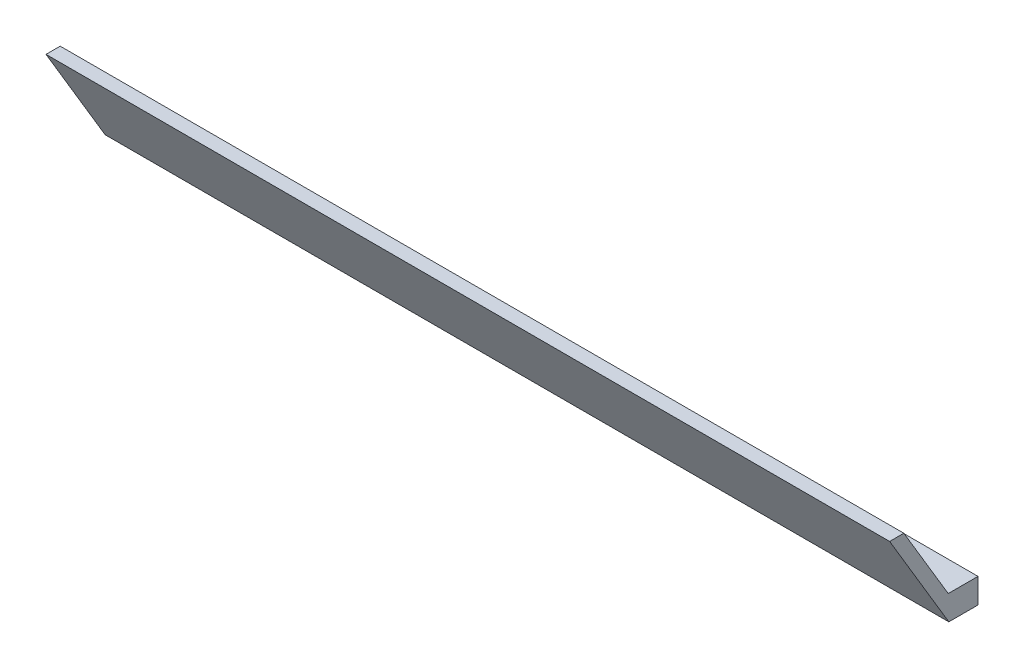
from build123d import *

# Parameters (mm, degrees)
EXTRUDE_1_DEPTH = 85


with BuildPart() as part:
    # 草图1 → 凸台-拉伸1 (new, symmetric)
    with BuildSketch(Plane(origin=(0, 0, 0), x_dir=(0, 0, -1), z_dir=(1, 0, 0))):
        Polygon((0, 0), (6, 0), (6, -5), (0.120203488, -5), (-11.80531658, 15), (-8.944140051, 15), align=None)
    extrude(amount=EXTRUDE_1_DEPTH, both=True)


solid = part.part
